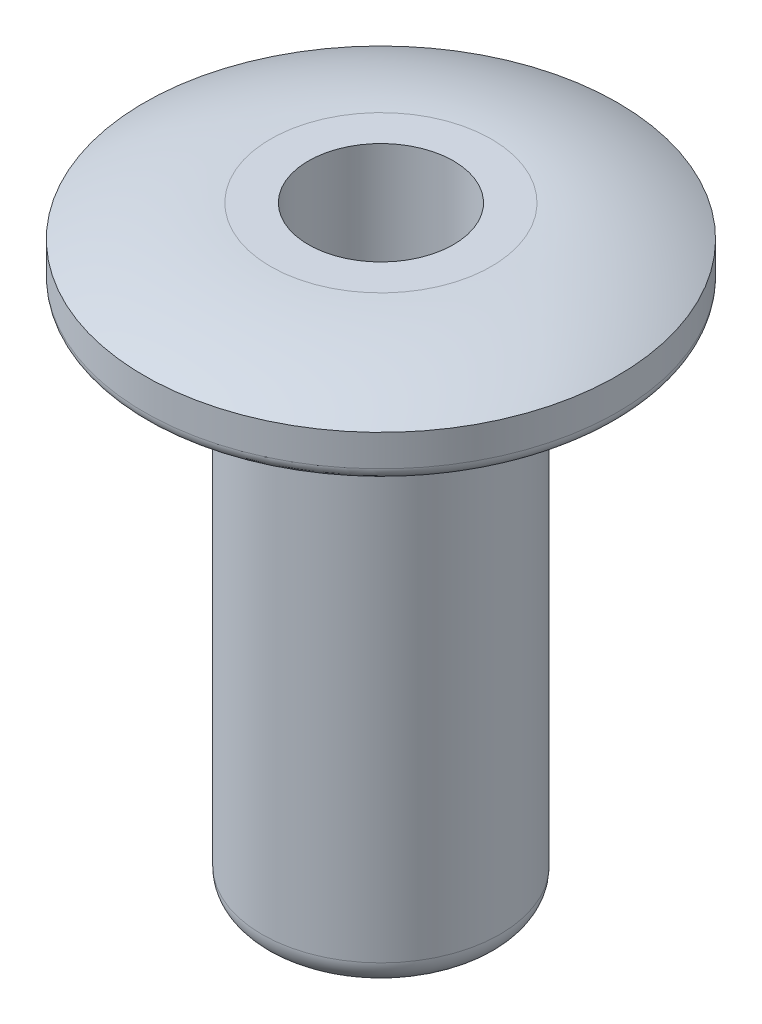
from build123d import *

# Parameters (mm, degrees)
FILLET1_R = 0.508


with BuildPart() as part:
    # Sketch1 → Revolve1 (revolve)
    with BuildSketch(Plane.XY, mode=Mode.PRIVATE) as revolve1_sk:
        with BuildLine():
            Line((-1.4605, 0), (-1.4605, 12.065))
            Line((-1.4605, 12.065), (-2.2225, 12.065))
            ThreePointArc((-2.2225, 12.065), (-3.531586036, 11.903844145), (-4.7625, 11.43))
            Line((-4.7625, 11.43), (-4.7625, 10.795))
            ThreePointArc((-4.7625, 10.795), (-4.688105122, 10.615394878), (-4.5085, 10.541))
            Line((-4.5085, 10.541), (-2.39395, 10.541))
            Line((-2.39395, 10.541), (-2.39395, 0))
            Line((-2.39395, 0), (-1.4605, 0))
        make_face()
    revolve(revolve1_sk.sketch.rotate(Axis((0, 0, 0), (0, 1, 0)), 270), axis=Axis((0, 0, 0), (0, 1, 0)))

    # Fillet1
    fillet1_edges = [part.edges().sort_by_distance(p)[0] for p in [
        (0, 0, 2.39395),
    ]]
    fillet(fillet1_edges, radius=FILLET1_R)


solid = part.part
